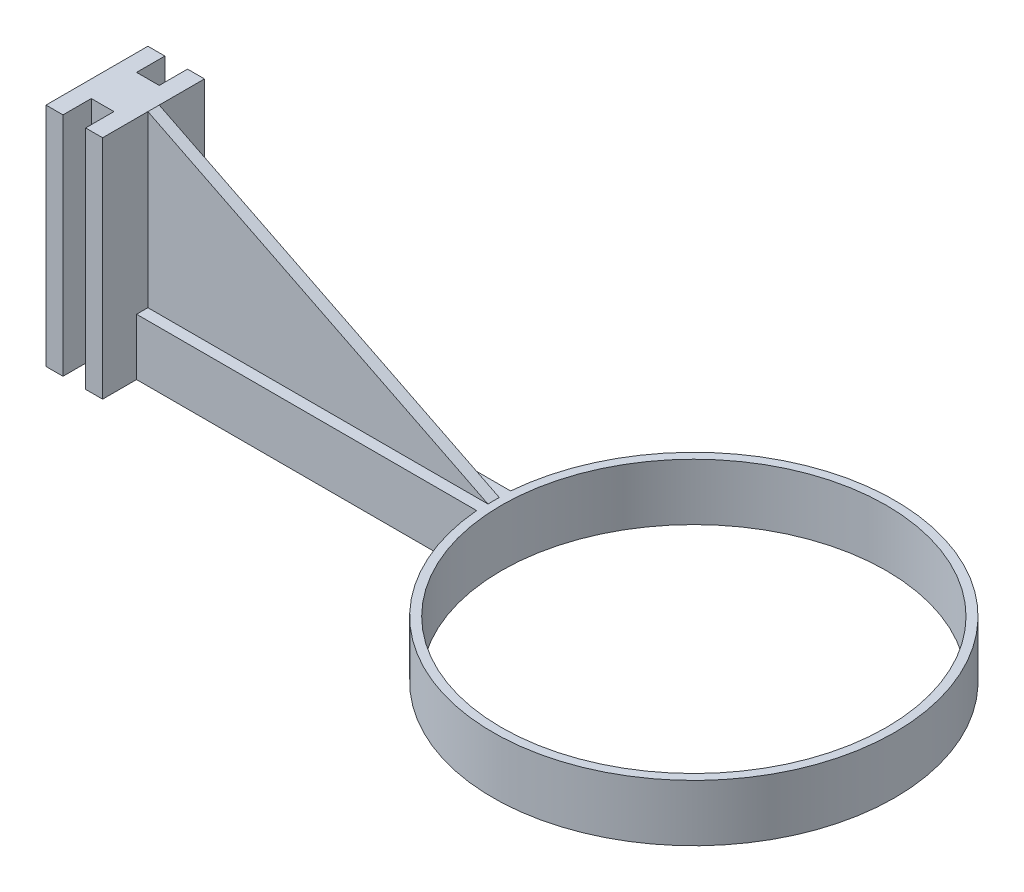
from build123d import *

# Parameters (mm, degrees)
SKETCH8_R            = 17
BOSS_EXTRUDE10_DEPTH = 5
BOSS_EXTRUDE11_DEPTH = 20
BOSS_EXTRUDE13_START = -1
BOSS_EXTRUDE13_DEPTH = 1


with BuildPart() as part:
    # Sketch8 → Boss-Extrude10 (new body)
    with BuildSketch(Plane(origin=(0, 0, 0), x_dir=(1, 0, 0), z_dir=(0, 1, 0))):
        with BuildLine():
            Line((-17.686506156, 1.5), (-47.720151855, 1.5))
            Line((-47.720151855, 1.5), (-47.720151855, -1.5))
            Line((-47.720151855, -1.5), (-17.686506156, -1.5))
            ThreePointArc((-17.686506156, -1.5), (17.75, 0), (-17.686506156, 1.5))
        make_face()
        Circle(SKETCH8_R, mode=Mode.SUBTRACT)
    extrude(amount=BOSS_EXTRUDE10_DEPTH)

    # Sketch8<3> → Boss-Extrude11 (add)
    with BuildSketch(Plane(origin=(0, 0, 0), x_dir=(1, 0, 0), z_dir=(0, 1, 0))):
        Polygon((-47.720151855, -1.5), (-47.720151855, 1.5), (-47.720151855, 4.5), (-49.220151855, 4.5), (-49.220151855, 2), (-51.220151855, 2), (-51.220151855, 4.5), (-52.720151855, 4.5), (-52.720151855, -4.5), (-51.220151855, -4.5), (-51.220151855, -2), (-49.220151855, -2), (-49.220151855, -4.5), (-47.720151855, -4.5), align=None)
    extrude(amount=BOSS_EXTRUDE11_DEPTH)

    # Sketch9 → Boss-Extrude13 (add)
    with BuildSketch(Plane.XY.offset(1.5).offset(BOSS_EXTRUDE13_START)):
        Polygon((-17.686506156, 5), (-47.720151855, 5), (-47.720151855, 20), align=None)
    extrude(amount=-BOSS_EXTRUDE13_DEPTH)


solid = part.part
